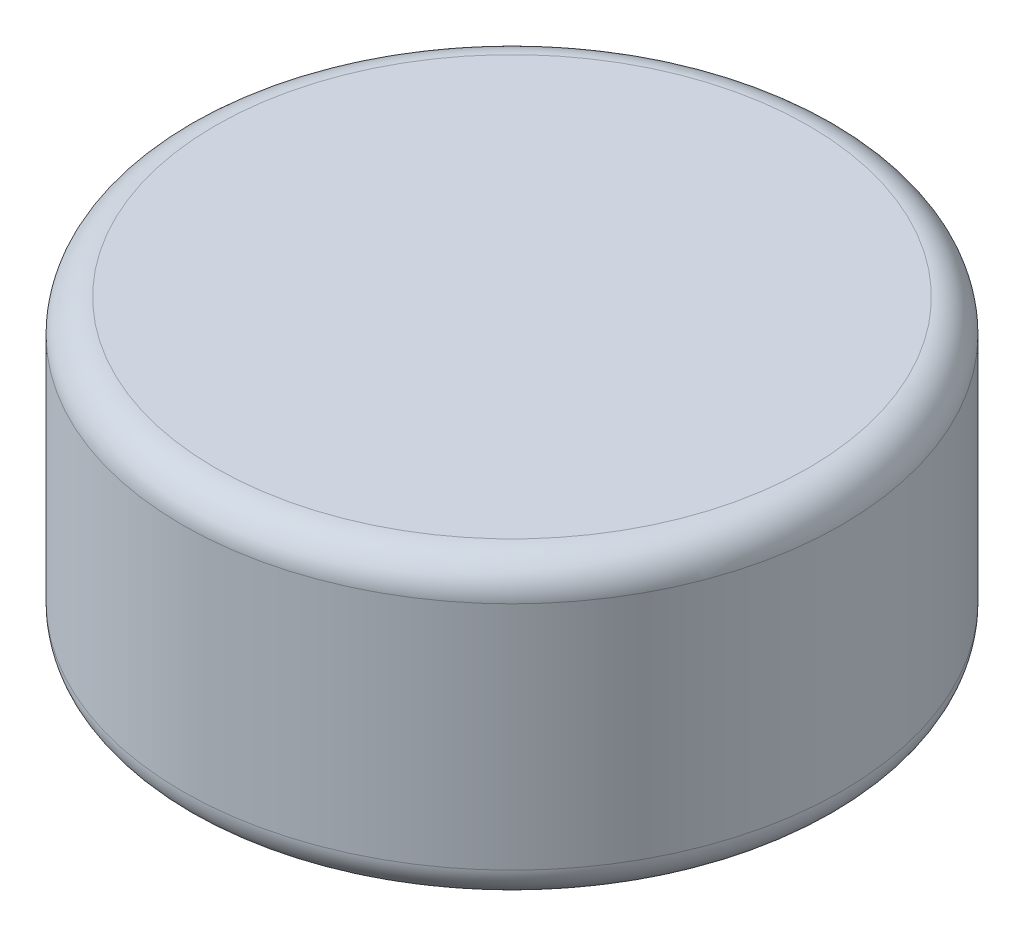
from build123d import *

# Parameters (mm, degrees)
SKETCH1_R           = 2
BOSS_EXTRUDE1_DEPTH = 1.8
FILLET1_R           = 0.2


with BuildPart() as part:
    # Sketch1 → Boss-Extrude1 (new body)
    with BuildSketch(Plane(origin=(0, 0, 0), x_dir=(1, 0, 0), z_dir=(0, 1, 0))):
        with Locations(Location((0, 0, 0), (0, 0, 270))):
            Circle(SKETCH1_R)
    extrude(amount=BOSS_EXTRUDE1_DEPTH)

    # Fillet1
    fillet1_edges = [part.edges().sort_by_distance(p)[0] for p in [
        (0, 0, -2),
        (0, 1.8, -2),
    ]]
    fillet(fillet1_edges, radius=FILLET1_R)


solid = part.part
